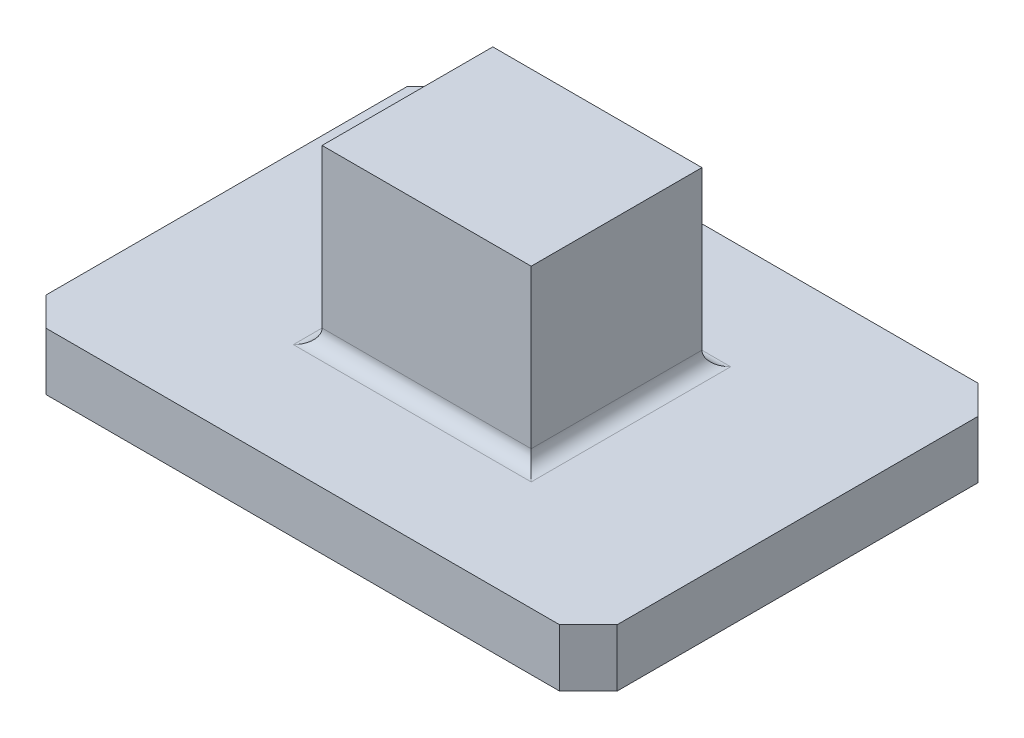
from build123d import *

# Parameters (mm, degrees)
ESQUISSE1_W        = 198.661449586
ESQUISSE1_H        = 145.541105456
BOSS_EXTRU_1_DEPTH = 20
ESQUISSE2_W        = 72.740275378
ESQUISSE2_H        = 59.392258424
BOSS_EXTRU_2_DEPTH = 60
CONG_1_R           = 5
CHANFREIN1_SIZE    = 10


with BuildPart() as part:
    # Esquisse1 → Boss.-Extru.1 (new body)
    with BuildSketch(Plane(origin=(0, 0, 0), x_dir=(1, 0, 0), z_dir=(0, 1, 0))):
        Rectangle(ESQUISSE1_W, ESQUISSE1_H)
    extrude(amount=BOSS_EXTRU_1_DEPTH)

    # Esquisse2 → Boss.-Extru.2 (add)
    with BuildSketch(Plane(origin=(0, 20, 0), x_dir=(1, 0, 0), z_dir=(0, 1, 0))):
        Rectangle(ESQUISSE2_W, ESQUISSE2_H)
    extrude(amount=BOSS_EXTRU_2_DEPTH)

    # Congé1
    cong_1_edges = [part.edges().sort_by_distance(p)[0] for p in [
        (36.370137689, 20, 0),
        (0, 20, -29.696129212),
        (-36.370137689, 20, 0),
        (0, 20, 29.696129212),
    ]]
    fillet(cong_1_edges, radius=CONG_1_R)

    # Chanfrein1
    chanfrein1_edges = [part.edges().sort_by_distance(p)[0] for p in [
        (99.330724793, 10, 72.770552728),
        (-99.330724793, 10, 72.770552728),
        (-99.330724793, 10, -72.770552728),
        (99.330724793, 10, -72.770552728),
    ]]
    chamfer(chanfrein1_edges, length=CHANFREIN1_SIZE)


solid = part.part
